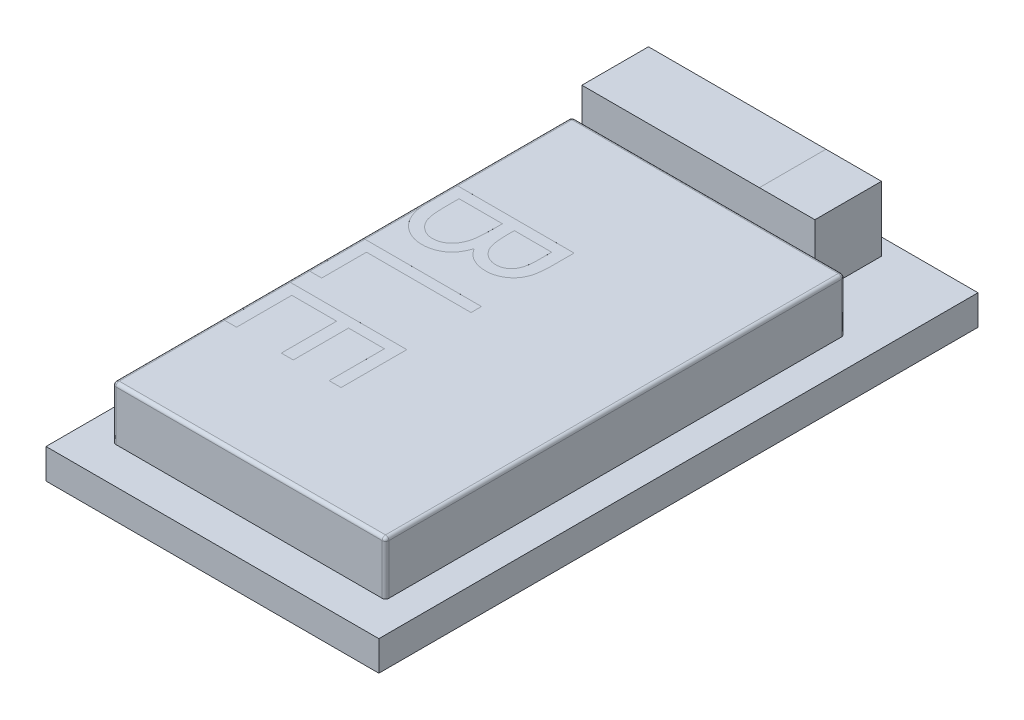
from build123d import *

# Parameters (mm, degrees)
SCHIZZO1_W                   = 10
SCHIZZO1_H                   = 18
ESTRUSIONE_ESTRUSIONE1_DEPTH = 0.9
SCHIZZO2_W                   = 8.2
SCHIZZO2_H                   = 13.8
ESTRUSIONE_ESTRUSIONE2_DEPTH = 1.6
RACCORDO1_R                  = 0.1
SCHIZZO3_W                   = 7
SCHIZZO3_H                   = 2
ESTRUSIONE_ESTRUSIONE3_DEPTH = 1.95
SCHIZZO4_W                   = 1.668109591
SCHIZZO4_H                   = 2
ESTRUSIONE_ESTRUSIONE4_DEPTH = 0.0001
TAGLIO_ESTRUSIONE1_DEPTH     = 0.0001


with BuildPart() as part:
    # Schizzo1 → Estrusione-Estrusione1 (new body)
    with BuildSketch(Plane(origin=(0, 0, 0), x_dir=(1, 0, 0), z_dir=(0, 1, 0))):
        with Locations((-8.221633561, 21.179815737)):
            Rectangle(SCHIZZO1_W, SCHIZZO1_H)
    extrude(amount=ESTRUSIONE_ESTRUSIONE1_DEPTH)

    # Schizzo2 → Estrusione-Estrusione2 (add)
    with BuildSketch(Plane(origin=(0, 0.9, 0), x_dir=(1, 0, 0), z_dir=(0, 1, 0))):
        with Locations((-8.221633561, 20.179815737)):
            Rectangle(SCHIZZO2_W, SCHIZZO2_H)
    extrude(amount=ESTRUSIONE_ESTRUSIONE2_DEPTH)

    # Raccordo1
    raccordo1_edges = [part.edges().sort_by_distance(p)[0] for p in [
        (-12.321633561, 1.7, -27.079815737),
        (-12.321633561, 1.7, -13.279815737),
        (-4.121633561, 1.7, -13.279815737),
        (-4.121633561, 1.7, -27.079815737),
        (-12.321633561, 2.5, -20.179815737),
        (-8.221633561, 2.5, -13.279815737),
        (-4.121633561, 2.5, -20.179815737),
        (-8.221633561, 2.5, -27.079815737),
    ]]
    fillet(raccordo1_edges, radius=RACCORDO1_R)

    # Schizzo3 → Estrusione-Estrusione3 (add)
    with BuildSketch(Plane(origin=(0, 0.9, 0), x_dir=(1, 0, 0), z_dir=(0, 1, 0))):
        with Locations((-9.121633561, 28.679815737)):
            Rectangle(SCHIZZO3_W, SCHIZZO3_H)
    extrude(amount=ESTRUSIONE_ESTRUSIONE3_DEPTH)

    # Schizzo4 → Estrusione-Estrusione4 (add)
    with BuildSketch(Plane(origin=(0, 2.85, 0), x_dir=(1, 0, 0), z_dir=(0, 1, 0))):
        with Locations((-6.455688357, 28.679815737)):
            Rectangle(SCHIZZO4_W, SCHIZZO4_H)
    extrude(amount=ESTRUSIONE_ESTRUSIONE4_DEPTH)

    # Schizzo6 → Taglio-Estrusione1 (cut)
    # profile 1 of 3: a face of its own
    with BuildSketch(Plane(origin=(0, 2.5, 0), x_dir=(1, 0, 0), z_dir=(0, 1, 0))):
        with BuildLine():
            Line((-8.721633561, 23.545200352), (-8.721633561, 22.862307724))
            add(Edge.make_bspline(
                [(-8.721633561, 22.862307724), (-8.721809311, 22.828879246), (-8.722149959, 22.764086535), (-8.72743309, 22.669867093), (-8.73463676, 22.581618283), (-8.746066853, 22.49931451), (-8.75985863, 22.422993808), (-8.776560446, 22.352426171), (-8.79658706, 22.287835998), (-8.828433341, 22.210723262), (-8.875756509, 22.122802601), (-8.945685074, 22.027604208), (-9.031217538, 21.946199969), (-9.127700193, 21.876013652), (-9.233835965, 21.820212532), (-9.347095154, 21.779843235), (-9.466016895, 21.75428536), (-9.547660073, 21.751656925), (-9.588921221, 21.750328557)],
                knots=[0, 0, 0, 0, 1.001505555, 1.941167018, 2.826882275, 3.653841531, 4.429895133, 5.150066043, 5.825578002, 6.45369114, 7.647487171, 8.808567382, 9.977351308, 11.170798116, 12.373658725, 13.556498008, 14.765093433, 16, 16, 16, 16], degree=3))
            add(Edge.make_bspline(
                [(-9.588921221, 21.750328557), (-9.627580326, 21.751400647), (-9.703549112, 21.753507404), (-9.814482881, 21.774339057), (-9.920517432, 21.805354415), (-10.020345579, 21.850379552), (-10.112684314, 21.908295812), (-10.196984871, 21.977991345), (-10.271204297, 22.060972988), (-10.31252402, 22.12324465), (-10.333512567, 22.154875833)],
                knots=[0, 0, 0, 0, 1.044266239, 2.052081639, 3.041743201, 4.026043445, 5.00270663, 5.980942822, 6.97441044, 8, 8, 8, 8], degree=3))
            add(Edge.make_bspline(
                [(-10.333512567, 22.154875833), (-10.348765786, 22.115108746), (-10.377948973, 22.039024459), (-10.429825242, 21.934247144), (-10.485612511, 21.843612441), (-10.546857455, 21.767020589), (-10.613698528, 21.702503806), (-10.684797277, 21.644566395), (-10.763653991, 21.596027836), (-10.848023281, 21.554329121), (-10.937313, 21.52151267), (-11.031114793, 21.498292878), (-11.128379786, 21.484025445), (-11.194675763, 21.482079939), (-11.228143977, 21.481097788)],
                knots=[0, 0, 0, 0, 1.272302504, 2.434229863, 3.488457646, 4.447234501, 5.35599188, 6.26022912, 7.18267843, 8.11661068, 9.06895546, 10.019249207, 11.000057067, 12, 12, 12, 12], degree=3))
            add(Edge.make_bspline(
                [(-11.228143977, 21.481097788), (-11.262310656, 21.48207494), (-11.329534553, 21.483997516), (-11.428292454, 21.498173108), (-11.522657231, 21.522198308), (-11.613299831, 21.555210245), (-11.699707184, 21.598539779), (-11.78296147, 21.650133961), (-11.860844851, 21.712930621), (-11.93520948, 21.782926386), (-12.002032852, 21.862204121), (-12.061524209, 21.947726181), (-12.110674198, 22.040722655), (-12.151445315, 22.139751415), (-12.183042722, 22.245470508), (-12.204979107, 22.357487955), (-12.219794287, 22.475828098), (-12.221010067, 22.557038433), (-12.221633561, 22.598685929)],
                knots=[0, 0, 0, 0, 0.978404568, 1.925038397, 2.85041836, 3.763147166, 4.682162379, 5.614488577, 6.562659439, 7.54271123, 8.535210642, 9.526693784, 10.520907202, 11.541451354, 12.589717429, 13.675358278, 14.807842563, 16, 16, 16, 16], degree=3))
            Line((-12.221633561, 22.598685929), (-12.221633561, 23.545200352))
            Line((-12.221633561, 23.545200352), (-8.721633561, 23.545200352))
        make_face()
        with BuildLine():
            Line((-9.08060792, 23.231097788), (-10.202402792, 23.231097788))
            Line((-10.202402792, 23.231097788), (-10.202402792, 23.020060128))
            add(Edge.make_bspline(
                [(-10.202402792, 23.020060128), (-10.202006197, 22.989211054), (-10.201239894, 22.929604358), (-10.198975616, 22.843055067), (-10.192913178, 22.762917749), (-10.18650115, 22.688916263), (-10.176627939, 22.621546602), (-10.164545903, 22.560583229), (-10.151879752, 22.505478502), (-10.130278548, 22.441959534), (-10.098677918, 22.369929866), (-10.048483138, 22.293631553), (-9.990321552, 22.225276288), (-9.921972987, 22.168200505), (-9.847351496, 22.121103006), (-9.766450427, 22.08967218), (-9.68242813, 22.067378707), (-9.624594659, 22.065423715), (-9.595231317, 22.064431121)],
                knots=[0, 0, 0, 0, 1.156481963, 2.23455883, 3.244418989, 4.168404366, 5.01828131, 5.794834307, 6.498111525, 7.13526334, 8.307595709, 9.435046769, 10.546766856, 11.659452936, 12.760769924, 13.837671619, 14.902137667, 16, 16, 16, 16], degree=3))
            add(Edge.make_bspline(
                [(-9.595231317, 22.064431121), (-9.575796396, 22.064927559), (-9.537672677, 22.065901376), (-9.482311145, 22.074764266), (-9.429577332, 22.087624406), (-9.38068408, 22.107715868), (-9.334241704, 22.132010599), (-9.292313019, 22.163613634), (-9.252600923, 22.199304177), (-9.216563546, 22.241219245), (-9.184273914, 22.289155884), (-9.155861871, 22.343570841), (-9.133449638, 22.405113859), (-9.113344673, 22.47238952), (-9.099394018, 22.546474511), (-9.087729412, 22.626644921), (-9.08179997, 22.713580859), (-9.081014133, 22.773725786), (-9.08060792, 22.804815737)],
                knots=[0, 0, 0, 0, 0.911752476, 1.788502045, 2.626783689, 3.45400582, 4.26402138, 5.080402872, 5.911472738, 6.767166405, 7.66795952, 8.620018292, 9.640966946, 10.73819047, 11.913090943, 13.176185384, 14.540321519, 16, 16, 16, 16], degree=3))
            Line((-9.08060792, 22.804815737), (-9.08060792, 23.231097788))
        make_face(mode=Mode.SUBTRACT)
        with BuildLine():
            Line((-10.561377151, 23.231097788), (-11.862659202, 23.231097788))
            Line((-11.862659202, 23.231097788), (-11.862659202, 22.783782083))
            add(Edge.make_bspline(
                [(-11.862659202, 22.783782083), (-11.862276795, 22.751762998), (-11.861539755, 22.690050433), (-11.859107362, 22.600951316), (-11.853690782, 22.518592948), (-11.844860313, 22.442927938), (-11.835684686, 22.373290226), (-11.822985174, 22.310371666), (-11.808547365, 22.254075798), (-11.786204171, 22.188807607), (-11.751552873, 22.115264242), (-11.698965819, 22.036065441), (-11.637141399, 21.964948169), (-11.564685457, 21.905248782), (-11.486498476, 21.855951368), (-11.402989401, 21.821376216), (-11.316705845, 21.799144888), (-11.257724028, 21.796517844), (-11.228143977, 21.795200352)],
                knots=[0, 0, 0, 0, 1.159821618, 2.235403267, 3.228114831, 4.14795534, 4.994323282, 5.771256229, 6.471395042, 7.097801288, 8.267864287, 9.404187171, 10.531774336, 11.667624178, 12.792825787, 13.866573821, 14.930062559, 16, 16, 16, 16], degree=3))
            add(Edge.make_bspline(
                [(-11.228143977, 21.795200352), (-11.209648244, 21.795469643), (-11.172955116, 21.796003882), (-11.119074178, 21.804363823), (-11.066648588, 21.816026487), (-11.016471096, 21.832915026), (-10.967725208, 21.854210104), (-10.921260001, 21.880934621), (-10.875964474, 21.911796374), (-10.818766488, 21.960074353), (-10.752842263, 22.030229244), (-10.688307172, 22.129941735), (-10.636258684, 22.243312419), (-10.614159305, 22.325540142), (-10.602743336, 22.368016858)],
                knots=[0, 0, 0, 0, 0.723503378, 1.435336582, 2.130201219, 2.824764462, 3.504949994, 4.209866579, 4.920640069, 5.648298893, 7.13757748, 8.670694625, 10.280166878, 12, 12, 12, 12], degree=3))
            add(Edge.make_bspline(
                [(-10.602743336, 22.368016858), (-10.59928802, 22.385045938), (-10.591796182, 22.421968496), (-10.583892945, 22.482176382), (-10.576803483, 22.551142736), (-10.571697091, 22.628572782), (-10.566215467, 22.714774469), (-10.564159524, 22.809720106), (-10.561650137, 22.913476814), (-10.561470474, 22.985469274), (-10.561377151, 23.022864615)],
                knots=[0, 0, 0, 0, 0.634452549, 1.375623993, 2.216454381, 3.166361212, 4.209414599, 5.370755378, 6.634280627, 8, 8, 8, 8], degree=3))
            Line((-10.561377151, 23.022864615), (-10.561377151, 23.231097788))
        make_face(mode=Mode.SUBTRACT)
    # profile 2 of 3: a face of its own
    with BuildSketch(Plane(origin=(0, 2.5, 0), x_dir=(1, 0, 0), z_dir=(0, 1, 0))):
        Polygon((-8.721633561, 20.76314907), (-8.721633561, 20.449046506), (-11.862659202, 20.449046506), (-11.862659202, 19.10289266), (-12.221633561, 19.10289266), (-12.221633561, 20.76314907), align=None)
    # profile 3 of 3: a face of its own
    with BuildSketch(Plane(origin=(0, 2.5, 0), x_dir=(1, 0, 0), z_dir=(0, 1, 0))):
        Polygon((-8.721633561, 18.519559326), (-8.721633561, 16.545200352), (-9.08060792, 16.545200352), (-9.08060792, 18.205456762), (-10.157530997, 18.205456762), (-10.157530997, 16.545200352), (-10.516505356, 16.545200352), (-10.516505356, 18.205456762), (-11.862659202, 18.205456762), (-11.862659202, 16.545200352), (-12.221633561, 16.545200352), (-12.221633561, 18.519559326), align=None)
    extrude(amount=-TAGLIO_ESTRUSIONE1_DEPTH, mode=Mode.SUBTRACT)


solid = part.part
